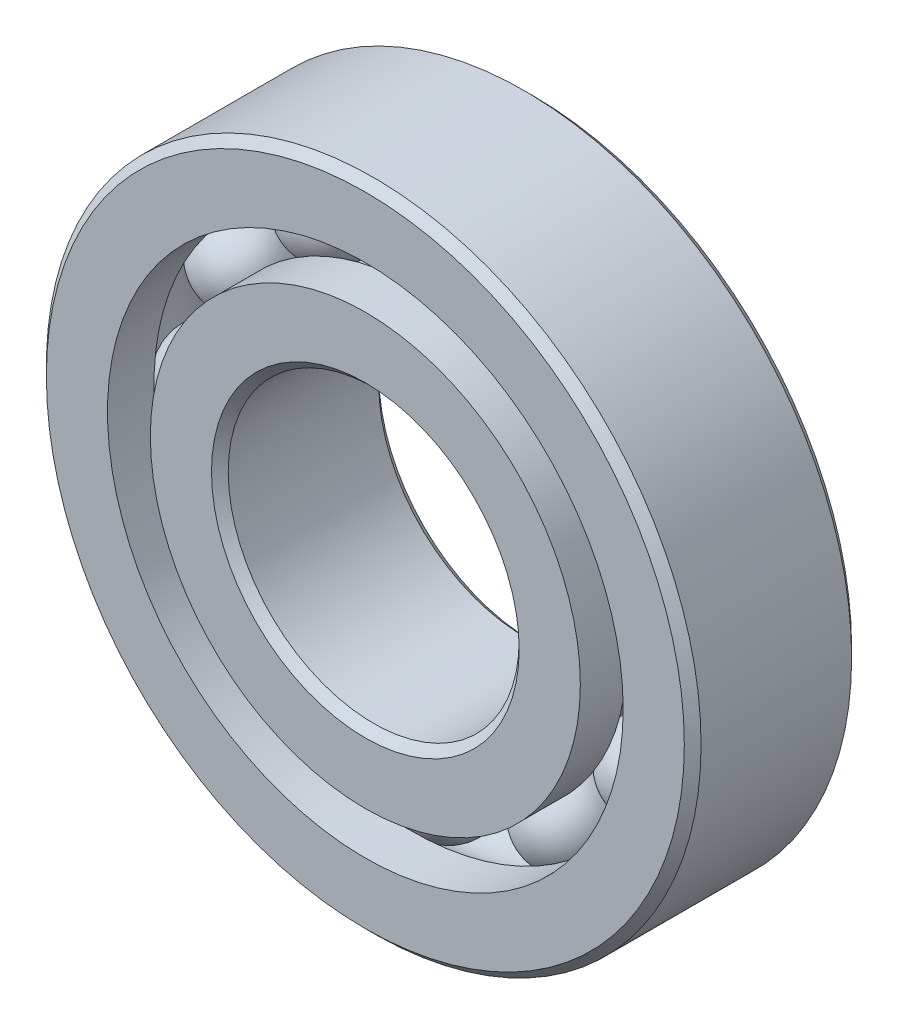
from build123d import *

# Parameters (mm, degrees)
CIRPATTERN1_COUNT = 12


with BuildPart() as part:
    # Sketch1 → Revolve1 (revolve)
    with BuildSketch(Plane(origin=(0, 0, 0), x_dir=(0, 0, -1), z_dir=(1, 0, 0))):
        with BuildLine():
            Line((10.35, 45), (-10.35, 45))
            Line((-10.35, 45), (-11.5, 43.85))
            Line((-11.5, 43.85), (-11.5, 35.445054945))
            Line((-11.5, 35.445054945), (-5.111111111, 35.445054945))
            ThreePointArc((-5.111111111, 35.445054945), (0, 38.398881709), (5.111111111, 35.445054945))
            Line((5.111111111, 35.445054945), (11.5, 35.445054945))
            Line((11.5, 35.445054945), (11.5, 43.85))
            Line((11.5, 43.85), (10.35, 45))
        make_face()
    revolve(axis=Axis((0, 0, 11.5), (0, 0, -1)))


with BuildPart() as body_2:
    # Sketch3 → Revolve3 (revolve)
    with BuildSketch(Plane(origin=(0, 0, 0), x_dir=(0, 0, -1), z_dir=(1, 0, 0))):
        with BuildLine():
            Line((-11.5, 29.554945055), (-5.111111111, 29.554945055))
            ThreePointArc((-5.111111111, 29.554945055), (0, 26.601118291), (5.111111111, 29.554945055))
            Line((5.111111111, 29.554945055), (11.5, 29.554945055))
            Line((11.5, 29.554945055), (11.5, 21.15))
            Line((11.5, 21.15), (10.35, 20))
            Line((10.35, 20), (-10.35, 20))
            Line((-10.35, 20), (-11.5, 21.15))
            Line((-11.5, 21.15), (-11.5, 29.554945055))
        make_face()
    revolve(axis=Axis((0, 0, 11.5), (0, 0, -1)))


with BuildPart() as body_3:
    # Sketch4 → Revolve4 (revolve)
    with BuildSketch(Plane(origin=(0, 0, 0), x_dir=(0, 0, -1), z_dir=(1, 0, 0))):
        with BuildLine():
            Line((-5.898881709, 32.5), (5.898881709, 32.5))
            ThreePointArc((5.898881709, 32.5), (0, 38.398881709), (-5.898881709, 32.5))
        make_face()
    revolve(axis=Axis((0, 32.5, 5.898881709), (0, 0, -1)))


with BuildPart() as cirpattern1_1:
    # CirPattern1: pattern copy
    add(body_3.part.rotate(Axis((0, 0, -11.5), (0, 0, 1)), 1 * 360 / CIRPATTERN1_COUNT))


with BuildPart() as cirpattern1_2:
    # CirPattern1: pattern copy
    add(body_3.part.rotate(Axis((0, 0, -11.5), (0, 0, 1)), 2 * 360 / CIRPATTERN1_COUNT))


with BuildPart() as cirpattern1_3:
    # CirPattern1: pattern copy
    add(body_3.part.rotate(Axis((0, 0, -11.5), (0, 0, 1)), 3 * 360 / CIRPATTERN1_COUNT))


with BuildPart() as cirpattern1_4:
    # CirPattern1: pattern copy
    add(body_3.part.rotate(Axis((0, 0, -11.5), (0, 0, 1)), 4 * 360 / CIRPATTERN1_COUNT))


with BuildPart() as cirpattern1_5:
    # CirPattern1: pattern copy
    add(body_3.part.rotate(Axis((0, 0, -11.5), (0, 0, 1)), 5 * 360 / CIRPATTERN1_COUNT))


with BuildPart() as cirpattern1_6:
    # CirPattern1: pattern copy
    add(body_3.part.rotate(Axis((0, 0, -11.5), (0, 0, 1)), 6 * 360 / CIRPATTERN1_COUNT))


with BuildPart() as cirpattern1_7:
    # CirPattern1: pattern copy
    add(body_3.part.rotate(Axis((0, 0, -11.5), (0, 0, 1)), 7 * 360 / CIRPATTERN1_COUNT))


with BuildPart() as cirpattern1_8:
    # CirPattern1: pattern copy
    add(body_3.part.rotate(Axis((0, 0, -11.5), (0, 0, 1)), 8 * 360 / CIRPATTERN1_COUNT))


with BuildPart() as cirpattern1_9:
    # CirPattern1: pattern copy
    add(body_3.part.rotate(Axis((0, 0, -11.5), (0, 0, 1)), 9 * 360 / CIRPATTERN1_COUNT))


with BuildPart() as cirpattern1_10:
    # CirPattern1: pattern copy
    add(body_3.part.rotate(Axis((0, 0, -11.5), (0, 0, 1)), 10 * 360 / CIRPATTERN1_COUNT))


with BuildPart() as cirpattern1_11:
    # CirPattern1: pattern copy
    add(body_3.part.rotate(Axis((0, 0, -11.5), (0, 0, 1)), 11 * 360 / CIRPATTERN1_COUNT))


solid = Compound([part.part, body_2.part, body_3.part, cirpattern1_1.part, cirpattern1_2.part, cirpattern1_3.part, cirpattern1_4.part, cirpattern1_5.part, cirpattern1_6.part, cirpattern1_7.part, cirpattern1_8.part, cirpattern1_9.part, cirpattern1_10.part, cirpattern1_11.part])
